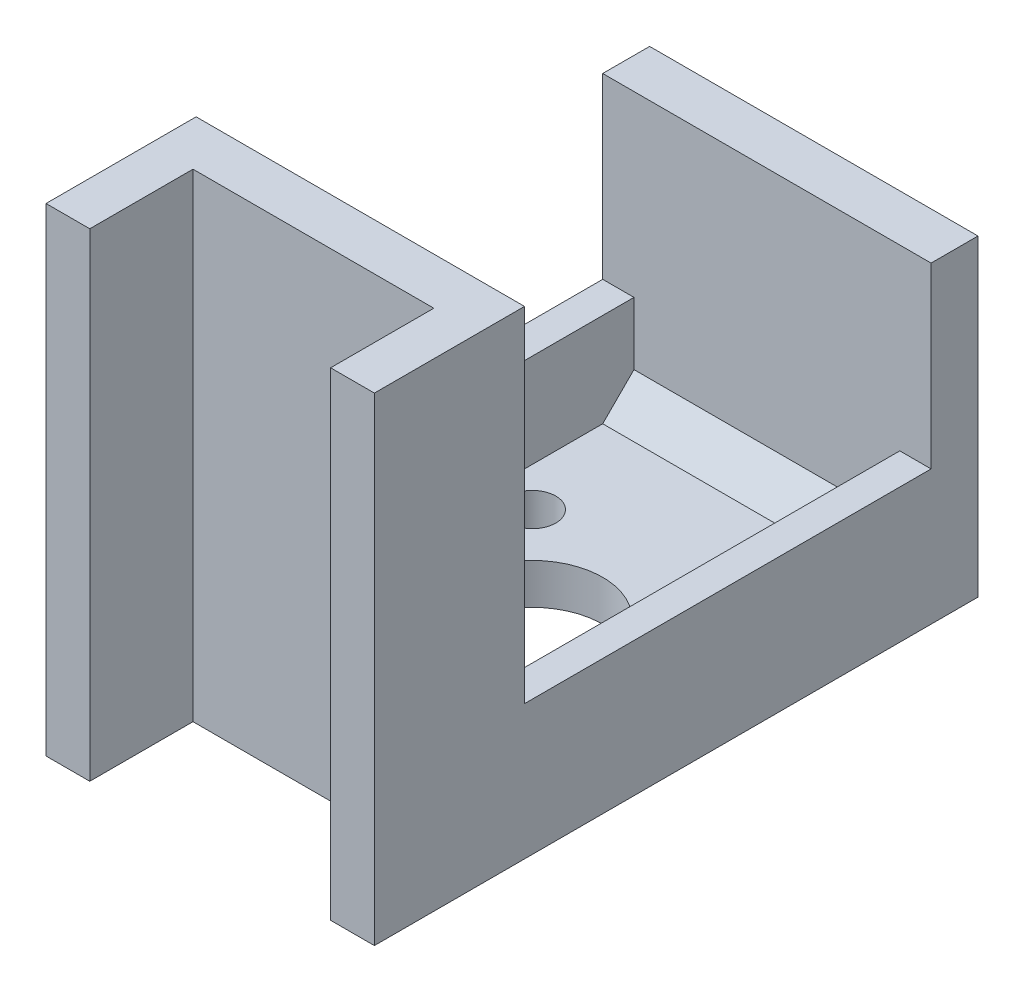
from build123d import *

# Parameters (mm, degrees)
SKETCH1_W           = 10.5
SKETCH1_H           = 14
SKETCH1_R           = 0.75
SKETCH1_R_2         = 2.25
BOSS_EXTRUDE1_DEPTH = 1.3
SKETCH2_W           = 10.5
SKETCH2_H           = 1.5
BOSS_EXTRUDE2_DEPTH = 14
SKETCH3_W           = 1.4
SKETCH3_H           = 3.3
BOSS_EXTRUDE3_DEPTH = 15.3
SKETCH4_W           = 10.5
SKETCH4_H           = 0.5
BOSS_EXTRUDE4_DEPTH = 1.3
SKETCH5_W           = 10.5
SKETCH5_H           = 1.5
BOSS_EXTRUDE5_DEPTH = 10
SKETCH6_W           = 1
SKETCH6_H           = 13
BOSS_EXTRUDE6_DEPTH = 3
CHAMFER1_SIZE       = 1


with BuildPart() as part:
    # Sketch1 → Boss-Extrude1 (new body)
    with BuildSketch(Plane(origin=(0, 0, 0), x_dir=(1, 0, 0), z_dir=(0, 1, 0))):
        Rectangle(SKETCH1_W, SKETCH1_H)
        with Locations(Location((-3, 3, 0), (0, 0, 270))):
            Circle(SKETCH1_R, mode=Mode.SUBTRACT)
        with Locations(Location((3, 3, 0), (0, 0, 270))):
            Circle(SKETCH1_R, mode=Mode.SUBTRACT)
        with Locations(Location((-3, -3, 0), (0, 0, 270))):
            Circle(SKETCH1_R, mode=Mode.SUBTRACT)
        with Locations(Location((3, -3, 0), (0, 0, 270))):
            Circle(SKETCH1_R, mode=Mode.SUBTRACT)
        with Locations(Location((0, 0, 0), (0, 0, 270))):
            Circle(SKETCH1_R_2, mode=Mode.SUBTRACT)
    extrude(amount=BOSS_EXTRUDE1_DEPTH)

    # Sketch2 → Boss-Extrude2 (add)
    with BuildSketch(Plane(origin=(0, 1.3, 0), x_dir=(1, 0, 0), z_dir=(0, 1, 0))):
        with Locations((0, -6.25)):
            Rectangle(SKETCH2_W, SKETCH2_H)
    extrude(amount=BOSS_EXTRUDE2_DEPTH)

    # Sketch3 → Boss-Extrude3 (add)
    with BuildSketch(Plane.XZ):
        with Locations((-4.55, 8.65)):
            Rectangle(SKETCH3_W, SKETCH3_H)
        with Locations((4.55, 8.65)):
            Rectangle(SKETCH3_W, SKETCH3_H)
    extrude(amount=-BOSS_EXTRUDE3_DEPTH)

    # Sketch4 → Boss-Extrude4 (add)
    with BuildSketch(Plane.XZ):
        with Locations((0, -7.25)):
            Rectangle(SKETCH4_W, SKETCH4_H)
    extrude(amount=-BOSS_EXTRUDE4_DEPTH)

    # Sketch5 → Boss-Extrude5 (add)
    with BuildSketch(Plane.XZ):
        with Locations((0, -8.25)):
            Rectangle(SKETCH5_W, SKETCH5_H)
    extrude(amount=-BOSS_EXTRUDE5_DEPTH)

    # Sketch6 → Boss-Extrude6 (add)
    with BuildSketch(Plane(origin=(0, 1.3, 0), x_dir=(1, 0, 0), z_dir=(0, 1, 0))):
        with Locations((4.75, 1)):
            Rectangle(SKETCH6_W, SKETCH6_H)
        with Locations((-4.75, 1)):
            Rectangle(SKETCH6_W, SKETCH6_H)
    extrude(amount=BOSS_EXTRUDE6_DEPTH)

    # Chamfer1
    chamfer1_edges = [part.edges().sort_by_distance(p)[0] for p in [
        (0, 1.3, -7.5),
    ]]
    chamfer(chamfer1_edges, length=CHAMFER1_SIZE)


solid = part.part
